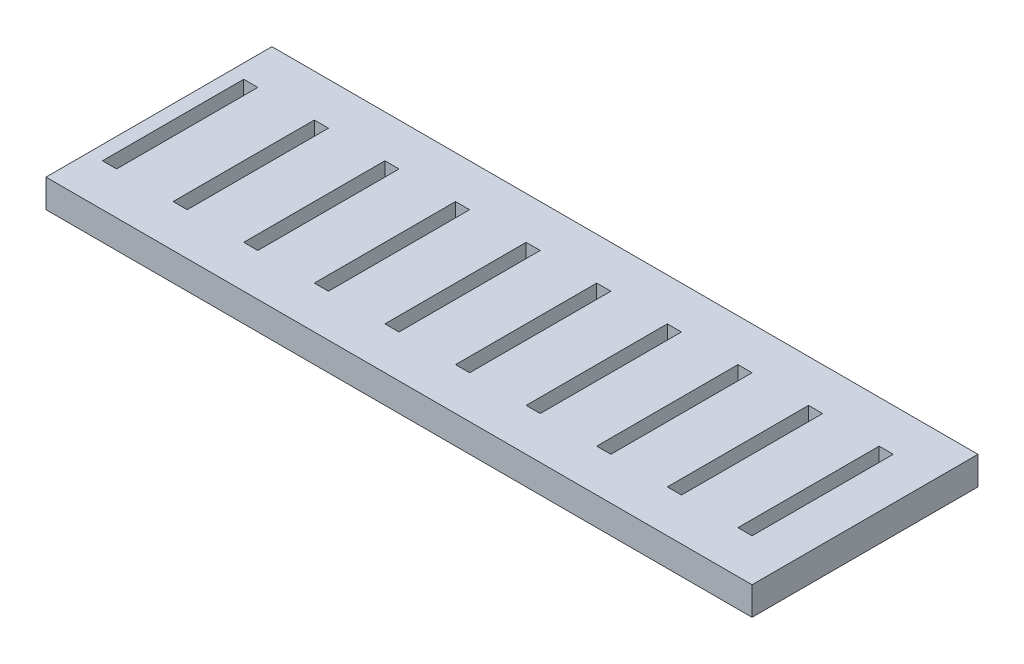
from build123d import *

# Parameters (mm, degrees)
SKETCH1_W              = 250
SKETCH1_H              = 80
CARD_BASE_DEPTH        = 10
SKETCH3_W              = 5
SKETCH3_H              = 50
F_2BRIDGE_HOLDER_DEPTH = 10
SKETCH5_W              = 5
SKETCH5_H              = 50
F_3BRIDGE_HOLDER_DEPTH = 10
SKETCH6_W              = 5
SKETCH6_H              = 50
F_4BRIDGE_HOLDER_DEPTH = 10
SKETCH7_W              = 5
SKETCH7_H              = 50
F_5BRIDGE_HOLDER_DEPTH = 10
SKETCH8_W              = 5
SKETCH8_H              = 50
F_6BRIDGE_HOLDER_DEPTH = 10
SKETCH9_W              = 5
SKETCH9_H              = 50
F_7_BH_DEPTH           = 10
SKETCH10_W             = 5
SKETCH10_H             = 50
F_8BH_DEPTH            = 10
SKETCH11_W             = 5
SKETCH11_H             = 50
F_9BH_DEPTH            = 10
SKETCH12_W             = 5
SKETCH12_H             = 50
F_10BH_DEPTH           = 10
SKETCH13_W             = 5
SKETCH13_H             = 50
F_11BH_DEPTH           = 10


with BuildPart() as part:
    # Sketch1 → Card Base (new body)
    with BuildSketch(Plane(origin=(0, 0, 0), x_dir=(1, 0, 0), z_dir=(0, 1, 0))):
        with Locations((-0.650367763, 0.037958261)):
            Rectangle(SKETCH1_W, SKETCH1_H)
    extrude(amount=CARD_BASE_DEPTH)

    # Sketch3 → 2bridge holder (cut)
    with BuildSketch(Plane(origin=(0, 10, 0), x_dir=(1, 0, 0), z_dir=(0, 1, 0))):
        with Locations((-118.150367763, 0.037958261)):
            Rectangle(SKETCH3_W, SKETCH3_H)
    extrude(amount=-F_2BRIDGE_HOLDER_DEPTH, mode=Mode.SUBTRACT)

    # Sketch5 → 3bridge holder (cut)
    with BuildSketch(Plane(origin=(0, 10, 0), x_dir=(1, 0, 0), z_dir=(0, 1, 0))):
        with Locations((-93.150367763, 0.037958261)):
            Rectangle(SKETCH5_W, SKETCH5_H)
    extrude(amount=-F_3BRIDGE_HOLDER_DEPTH, mode=Mode.SUBTRACT)

    # Sketch6 → 4Bridge holder (cut)
    with BuildSketch(Plane(origin=(0, 10, 0), x_dir=(1, 0, 0), z_dir=(0, 1, 0))):
        with Locations((-68.150367763, 0.037958261)):
            Rectangle(SKETCH6_W, SKETCH6_H)
    extrude(amount=-F_4BRIDGE_HOLDER_DEPTH, mode=Mode.SUBTRACT)

    # Sketch7 → 5Bridge holder (cut)
    with BuildSketch(Plane(origin=(0, 10, 0), x_dir=(1, 0, 0), z_dir=(0, 1, 0))):
        with Locations((-43.150367763, 0.037958261)):
            Rectangle(SKETCH7_W, SKETCH7_H)
    extrude(amount=-F_5BRIDGE_HOLDER_DEPTH, mode=Mode.SUBTRACT)

    # Sketch8 → 6bridge holder (cut)
    with BuildSketch(Plane(origin=(0, 10, 0), x_dir=(1, 0, 0), z_dir=(0, 1, 0))):
        with Locations((-18.150367763, 0.037958261)):
            Rectangle(SKETCH8_W, SKETCH8_H)
    extrude(amount=-F_6BRIDGE_HOLDER_DEPTH, mode=Mode.SUBTRACT)

    # Sketch9 → 7 BH (cut)
    with BuildSketch(Plane(origin=(0, 10, 0), x_dir=(1, 0, 0), z_dir=(0, 1, 0))):
        with Locations((6.849632237, 0.037958261)):
            Rectangle(SKETCH9_W, SKETCH9_H)
    extrude(amount=-F_7_BH_DEPTH, mode=Mode.SUBTRACT)

    # Sketch10 → 8BH (cut)
    with BuildSketch(Plane(origin=(0, 10, 0), x_dir=(1, 0, 0), z_dir=(0, 1, 0))):
        with Locations((31.849632237, 0.037958261)):
            Rectangle(SKETCH10_W, SKETCH10_H)
    extrude(amount=-F_8BH_DEPTH, mode=Mode.SUBTRACT)

    # Sketch11 → 9BH (cut)
    with BuildSketch(Plane(origin=(0, 10, 0), x_dir=(1, 0, 0), z_dir=(0, 1, 0))):
        with Locations((56.849632237, 0.037958261)):
            Rectangle(SKETCH11_W, SKETCH11_H)
    extrude(amount=-F_9BH_DEPTH, mode=Mode.SUBTRACT)

    # Sketch12 → 10BH (cut)
    with BuildSketch(Plane(origin=(0, 10, 0), x_dir=(1, 0, 0), z_dir=(0, 1, 0))):
        with Locations((81.849632237, 0.037958261)):
            Rectangle(SKETCH12_W, SKETCH12_H)
    extrude(amount=-F_10BH_DEPTH, mode=Mode.SUBTRACT)

    # Sketch13 → 11BH (cut)
    with BuildSketch(Plane(origin=(0, 10, 0), x_dir=(1, 0, 0), z_dir=(0, 1, 0))):
        with Locations((106.849632237, 0.037958261)):
            Rectangle(SKETCH13_W, SKETCH13_H)
    extrude(amount=-F_11BH_DEPTH, mode=Mode.SUBTRACT)


solid = part.part
